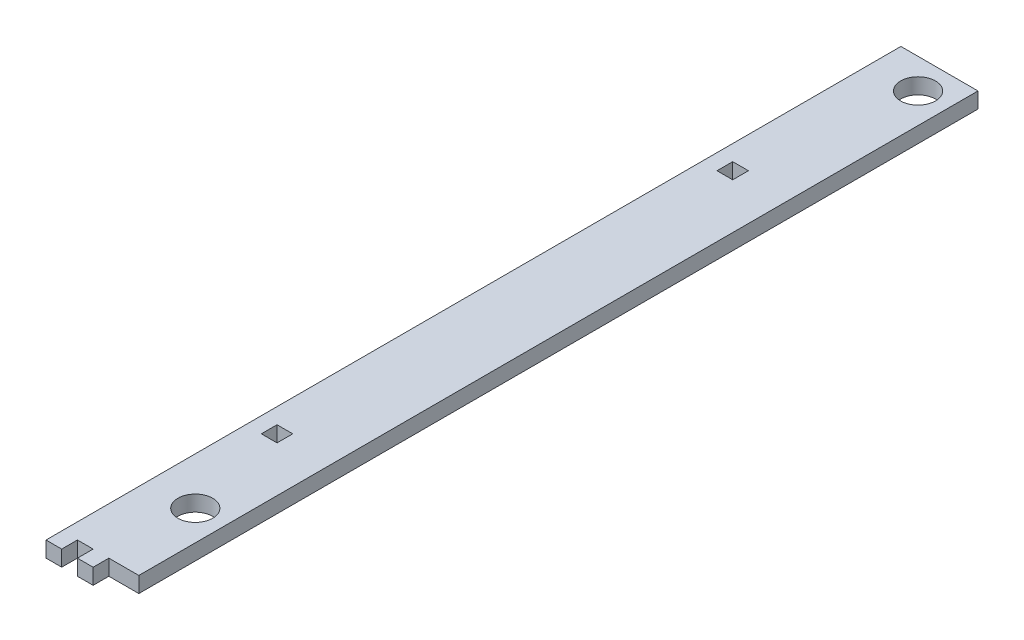
from build123d import *

# Parameters (mm, degrees)
AXLE_SUPPORT_PLATE_R = 7.030128061
AXLE_SUPPORT_PLATE_W = 6.35
AXLE_SUPPORT_PLATE_H = 6.35
BOSS_EXTRUDE1_DEPTH  = 6.35


with BuildPart() as part:
    # Axle Support Plate → Boss-Extrude1 (new body)
    with BuildSketch(Plane(origin=(0, 0, 0), x_dir=(1, 0, 0), z_dir=(0, 1, 0))):
        Polygon((31.160128061, -169.56756403), (31.160128061, 169.56756403), (0, 169.56756403), (0, -175.91756403), (6.35, -175.91756403), (6.35, -169.56756403), (12.7, -169.56756403), (12.7, -175.91756403), (19.05, -175.91756403), (19.05, -169.56756403), align=None)
        with Locations(Location((19.05, 157.45743597, 0), (0, 0, 270))):
            Circle(AXLE_SUPPORT_PLATE_R, mode=Mode.SUBTRACT)
        with Locations(Location((19.05, -134.64256403, 0), (0, 0, 90))):
            Circle(AXLE_SUPPORT_PLATE_R, mode=Mode.SUBTRACT)
        with Locations((9.525, -92.075)):
            Rectangle(AXLE_SUPPORT_PLATE_W, AXLE_SUPPORT_PLATE_H, mode=Mode.SUBTRACT)
        with Locations((9.525, 92.075)):
            Rectangle(AXLE_SUPPORT_PLATE_W, AXLE_SUPPORT_PLATE_H, mode=Mode.SUBTRACT)
    extrude(amount=BOSS_EXTRUDE1_DEPTH)


solid = part.part
